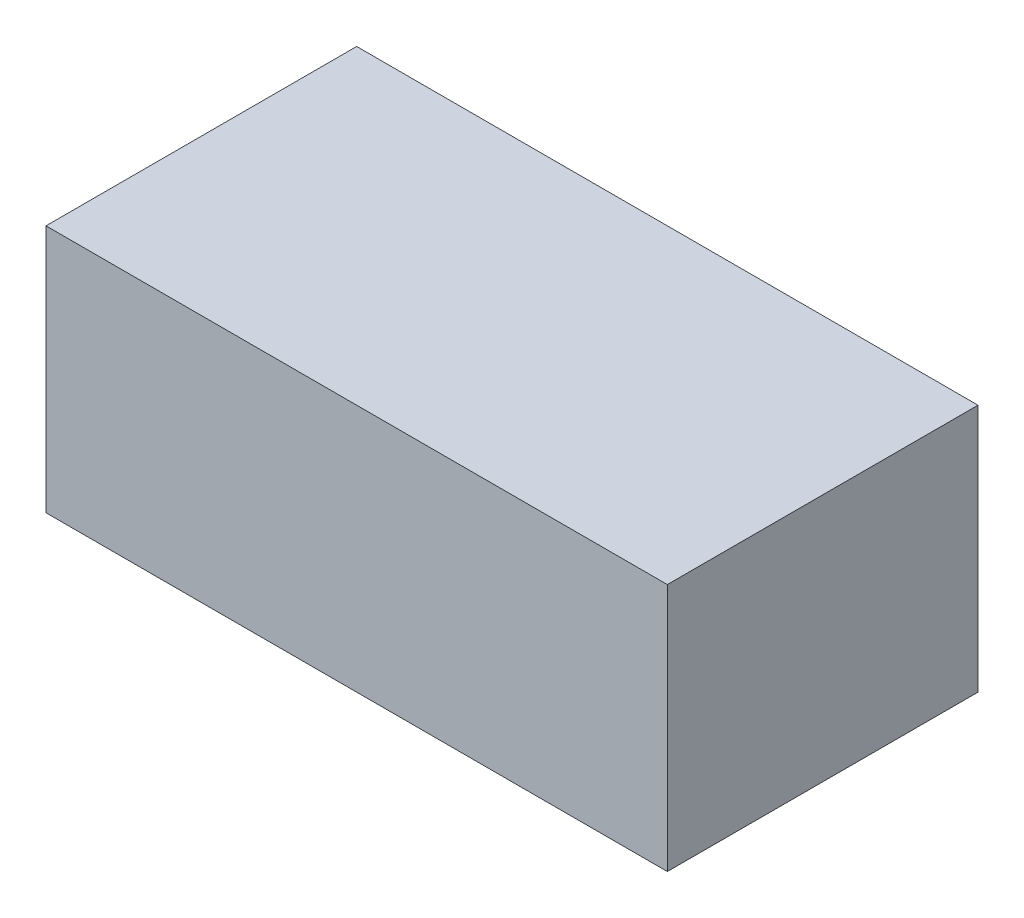
from build123d import *

# Parameters (mm, degrees)
ESQUISSE1_W          = 30
ESQUISSE1_H          = 12
BASE_EXTRUSION_DEPTH = 15


with BuildPart() as part:
    # Esquisse1 → Base-Extrusion (new body)
    with BuildSketch(Plane.XY):
        with Locations((15, 6)):
            Rectangle(ESQUISSE1_W, ESQUISSE1_H)
    extrude(amount=BASE_EXTRUSION_DEPTH)


solid = part.part
